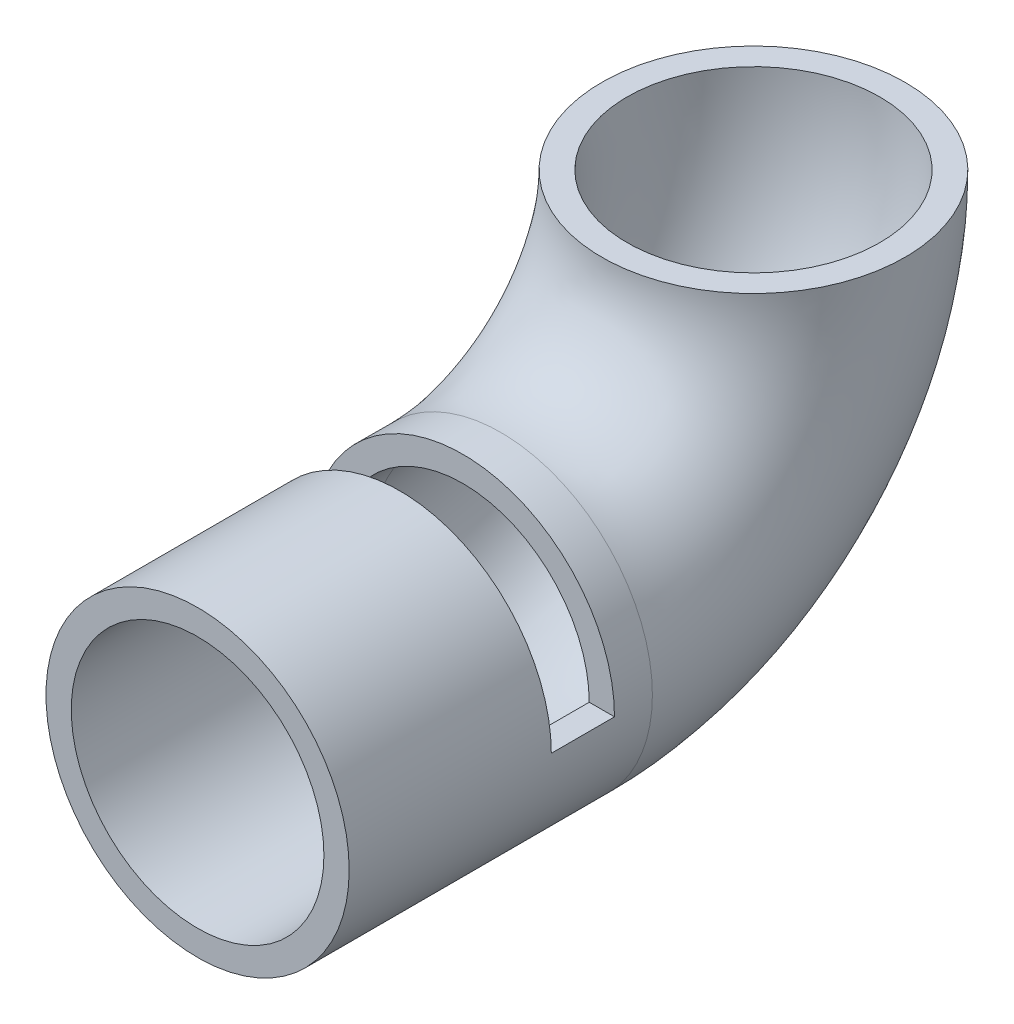
from build123d import *

# Parameters (mm, degrees)
SKETCH1_R          = 19.05
SKETCH1_R_2        = 15.875
CUT_EXTRUDE1_START = -7.9375
CUT_EXTRUDE1_DEPTH = 7.9375


with BuildPart() as part:
    # Sweep1: sweep along a path in Sketch2
    with BuildLine(Plane(origin=(0, 0, 0), x_dir=(0, 0, -1), z_dir=(1, 0, 0))) as sweep1_path:
        Line((0, 0), (38.1, 0))
        ThreePointArc((38.1, 0), (60.550640303, 9.299359697), (69.85, 31.75))
    # Sketch1 → Sweep1 (sweep)
    with BuildSketch(Plane.XY):
        Circle(SKETCH1_R)
        Circle(SKETCH1_R_2, mode=Mode.SUBTRACT)
    sweep(path=sweep1_path.line)

    # Sketch3 → Cut-Extrude1 (cut)
    with BuildSketch(Plane.XY.offset(-25.4).offset(CUT_EXTRUDE1_START)):
        with BuildLine():
            Line((-19.05, 0), (-15.875, 0))
            ThreePointArc((-15.875, 0), (0, 15.875), (15.875, 0))
            Line((15.875, 0), (19.05, 0))
            ThreePointArc((19.05, 0), (0, 19.05), (-19.05, 0))
        make_face()
    extrude(amount=CUT_EXTRUDE1_DEPTH, mode=Mode.SUBTRACT)


solid = part.part
